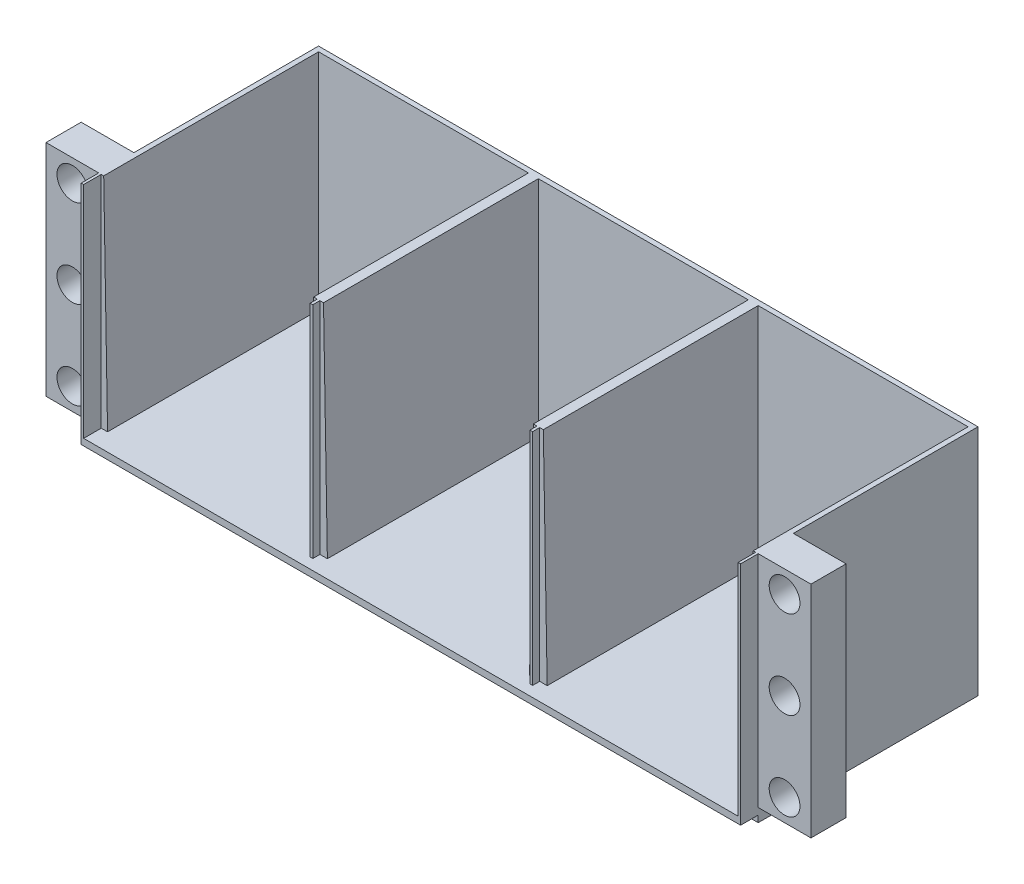
from build123d import *

# Parameters (mm, degrees)
SKETCH2_W            = 75
SKETCH2_H            = 25
BOSS_EXTRUDE1_DEPTH  = 1.5
BOSS_EXTRUDE5_DEPTH  = 25
BOSS_EXTRUDE5_TAPER  = 1
SKETCH6_W            = 75
SKETCH6_H            = 0.75
BOSS_EXTRUDE6_DEPTH  = 2
BOSS_EXTRUDE7_REACH  = 85.38
BOSS_EXTRUDE8_DEPTH  = 0.436377
SKETCH10_W           = 0.281811688
SKETCH10_H           = 25
BOSS_EXTRUDE9_DEPTH  = 2
SKETCH13_W           = 4
SKETCH13_H           = 25
BOSS_EXTRUDE10_DEPTH = 6
SKETCH14_W           = 4
SKETCH14_H           = 25
BOSS_EXTRUDE11_DEPTH = 6
SKETCH15_R           = 1.75
CUT_EXTRUDE1_DEPTH   = 6
SKETCH16_W           = 0.3
SKETCH16_H           = 25
BOSS_EXTRUDE12_DEPTH = 0.8


with BuildPart() as part:
    # Sketch2 → Boss-Extrude1 (new body)
    with BuildSketch(Plane(origin=(0, 0, 0), x_dir=(1, 0, 0), z_dir=(0, 1, 0))):
        with Locations((37.5, 12.5)):
            Rectangle(SKETCH2_W, SKETCH2_H)
    extrude(amount=BOSS_EXTRUDE1_DEPTH)

    # Sketch4 → Boss-Extrude5 (add)
    with BuildSketch(Plane(origin=(0, 1.5, 0), x_dir=(1, 0, 0), z_dir=(0, 1, 0))):
        Polygon((24, 25), (0, 25), (0, 0), (1, 0), (1, 24), (24, 24), (24, 0), (26, 0), (26, 24), (49, 24), (49, 0), (51, 0), (51, 24), (74, 24), (74, 0), (75, 0), (75, 25), (51, 25), (49, 25), (26, 25), align=None)
    extrude(amount=BOSS_EXTRUDE5_DEPTH, taper=BOSS_EXTRUDE5_TAPER)

    # Sketch6 → Boss-Extrude6 (add)
    with BuildSketch(Plane.XY):
        with Locations((37.5, 1.125)):
            Rectangle(SKETCH6_W, SKETCH6_H)
    extrude(amount=BOSS_EXTRUDE6_DEPTH)

    # Boss-Extrude7: up to this face of the body (flat: up to its plane)
    boss_extrude7_end = Plane(part.part.faces().sort_by_distance((37.5, 1.5, -10.920265781))[0])
    # Sketch8 → Boss-Extrude7 (add, up to the picked face)
    with BuildSketch(Plane(origin=(0, 26.5, 0), x_dir=(1, 0, 0), z_dir=(0, 1, 0)), mode=Mode.PRIVATE) as boss_extrude7_sk1:
        Polygon((0, 25), (0, 0), (0.436376623, 0.436376623), (0.436376623, 24.563623377), (74.563623377, 24.563623377), (74.563623377, 0.436376623), (75, 0), (75, 25), align=None)
    boss_extrude7_tool1 = split(extrude(boss_extrude7_sk1.sketch, amount=-BOSS_EXTRUDE7_REACH, mode=Mode.PRIVATE), bisect_by=boss_extrude7_end, keep=Keep.BOTH, mode=Mode.PRIVATE)
    add(boss_extrude7_tool1.solids().sort_by(Axis((0.079057, 26.5, -12.5), (0, -1, 0)))[0])

    # Sketch9 → Boss-Extrude8 (add)
    with BuildSketch(Plane(origin=(0, 0, 0), x_dir=(-1, 0, 0), z_dir=(0, 0, -1))):
        Polygon((-75, 1.5), (-75, 26.5), (-74.563623377, 26.5), (-74.436376623, 26.5), (-74, 1.5), align=None)
        Polygon((-49, 1.5), (-51, 1.5), (-50.563623377, 26.5), (-49.436376623, 26.5), align=None)
        Polygon((-0.436376623, 26.5), (0, 26.5), (0, 1.5), (-1, 1.5), (-0.563623377, 26.5), align=None)
        Polygon((-24, 1.5), (-26, 1.5), (-25.563623377, 26.5), (-24.436376623, 26.5), align=None)
    extrude(amount=BOSS_EXTRUDE8_DEPTH)

    # Sketch10 → Boss-Extrude9 (add)
    with BuildSketch(Plane.XY):
        with Locations((0.140905844, 14)):
            Rectangle(SKETCH10_W, SKETCH10_H)
        with Locations((74.859094156, 14)):
            Rectangle(SKETCH10_W, SKETCH10_H)
    extrude(amount=BOSS_EXTRUDE9_DEPTH)

    # Sketch13 → Boss-Extrude10 (add)
    with BuildSketch(Plane.ZY):
        with Locations((-2, 14)):
            Rectangle(SKETCH13_W, SKETCH13_H)
    extrude(amount=BOSS_EXTRUDE10_DEPTH)

    # Sketch14 → Boss-Extrude11 (add)
    with BuildSketch(Plane(origin=(75, 0, 0), x_dir=(0, 0, -1), z_dir=(1, 0, 0))):
        with Locations((2, 14)):
            Rectangle(SKETCH14_W, SKETCH14_H)
    extrude(amount=BOSS_EXTRUDE11_DEPTH)

    # Sketch15 → Cut-Extrude1 (cut)
    with BuildSketch(Plane.XY):
        with Locations((-3, 24)):
            Circle(SKETCH15_R)
        with Locations((78, 24)):
            Circle(SKETCH15_R)
        with Locations((-3, 14)):
            Circle(SKETCH15_R)
        with Locations((-3, 4)):
            Circle(SKETCH15_R)
        with Locations((78, 14)):
            Circle(SKETCH15_R)
        with Locations((78, 4)):
            Circle(SKETCH15_R)
    extrude(amount=-CUT_EXTRUDE1_DEPTH, mode=Mode.SUBTRACT)

    # Sketch16 → Boss-Extrude12 (add)
    with BuildSketch(Plane.XY):
        with Locations((25, 14)):
            Rectangle(SKETCH16_W, SKETCH16_H)
        with Locations((50, 14)):
            Rectangle(SKETCH16_W, SKETCH16_H)
    extrude(amount=BOSS_EXTRUDE12_DEPTH)


solid = part.part
